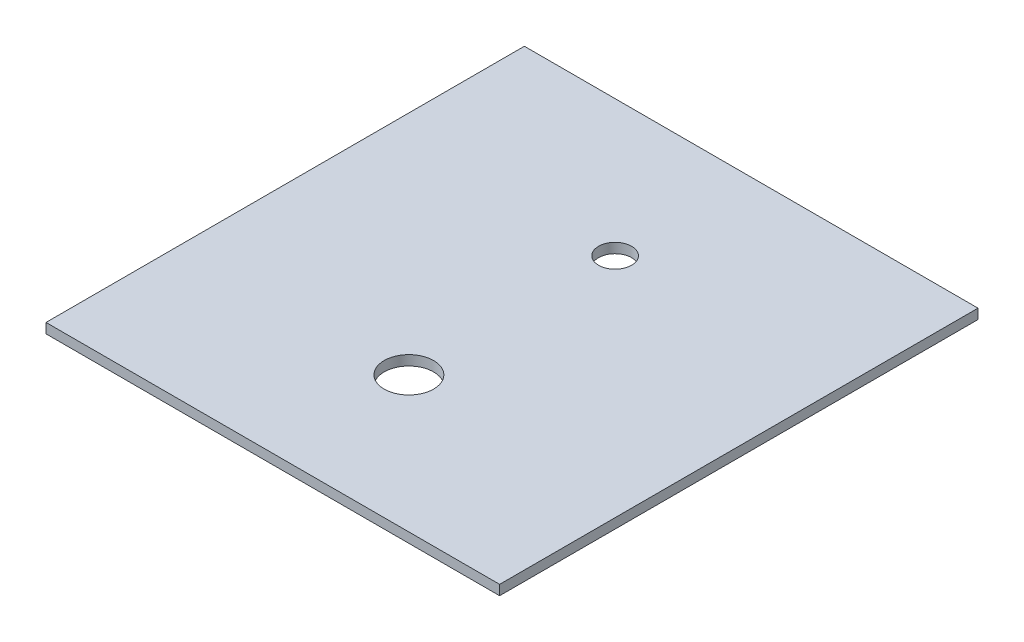
from build123d import *

# Parameters (mm, degrees)
SKETCH1_W           = 55
SKETCH1_H           = 58
SKETCH1_R           = 3
SKETCH1_R_2         = 2
BOSS_EXTRUDE1_DEPTH = 1.2


with BuildPart() as part:
    # Sketch1 → Boss-Extrude1 (new body)
    with BuildSketch(Plane(origin=(0, 0, 0), x_dir=(1, 0, 0), z_dir=(0, 1, 0))):
        Rectangle(SKETCH1_W, SKETCH1_H)
        with Locations(Location((0, -12.5, 0), (0, 0, 270))):
            Circle(SKETCH1_R, mode=Mode.SUBTRACT)
        with Locations(Location((0, 12.5, 0), (0, 0, 270))):
            Circle(SKETCH1_R_2, mode=Mode.SUBTRACT)
    extrude(amount=BOSS_EXTRUDE1_DEPTH)


solid = part.part
